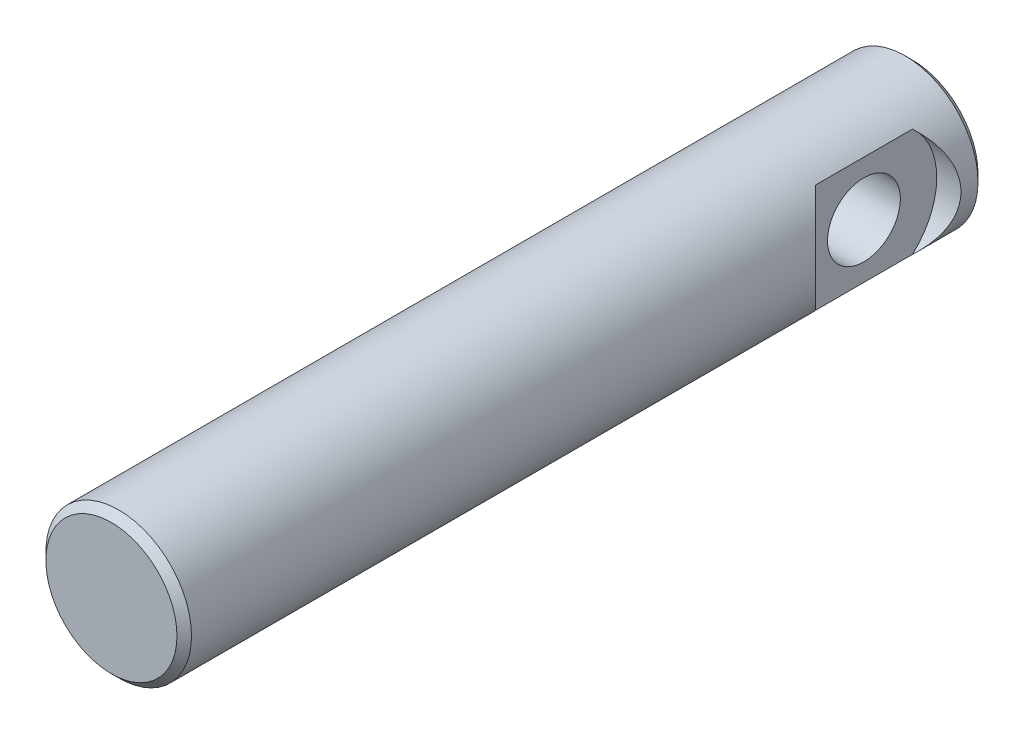
from build123d import *

# Parameters (mm, degrees)
ESQUISSE1_R        = 3
BOSS_EXTRU_1_DEPTH = 33
CHANFREIN1_SIZE    = 0.3


with BuildPart() as part:
    # Esquisse1 → Boss.-Extru.1 (new body)
    with BuildSketch(Plane.XY):
        Circle(ESQUISSE1_R)
    extrude(amount=BOSS_EXTRU_1_DEPTH)

    # Esquisse2 → Enlèvement de matière-Révolution1 (revolve, cut)
    with BuildSketch(Plane(origin=(0, 0, 0), x_dir=(1, 0, 0), z_dir=(0, 1, 0)), mode=Mode.PRIVATE) as enl_vement_de_mati_re_r_volution1_sk:
        Polygon((-10, -2.5), (2, -2.5), (2, -1), (10, -1), (10, -4), (-10, -4), align=None)
    revolve(enl_vement_de_mati_re_r_volution1_sk.sketch.rotate(Axis((10, 0, 4), (1, 0, 0)), 180), axis=Axis((10, 0, 4), (1, 0, 0)), mode=Mode.SUBTRACT)

    # Chanfrein1
    chanfrein1_edges = [part.edges().sort_by_distance(p)[0] for p in [
        (-3, 0, 0),
        (-3, 0, 33),
    ]]
    chamfer(chanfrein1_edges, length=CHANFREIN1_SIZE)


solid = part.part
